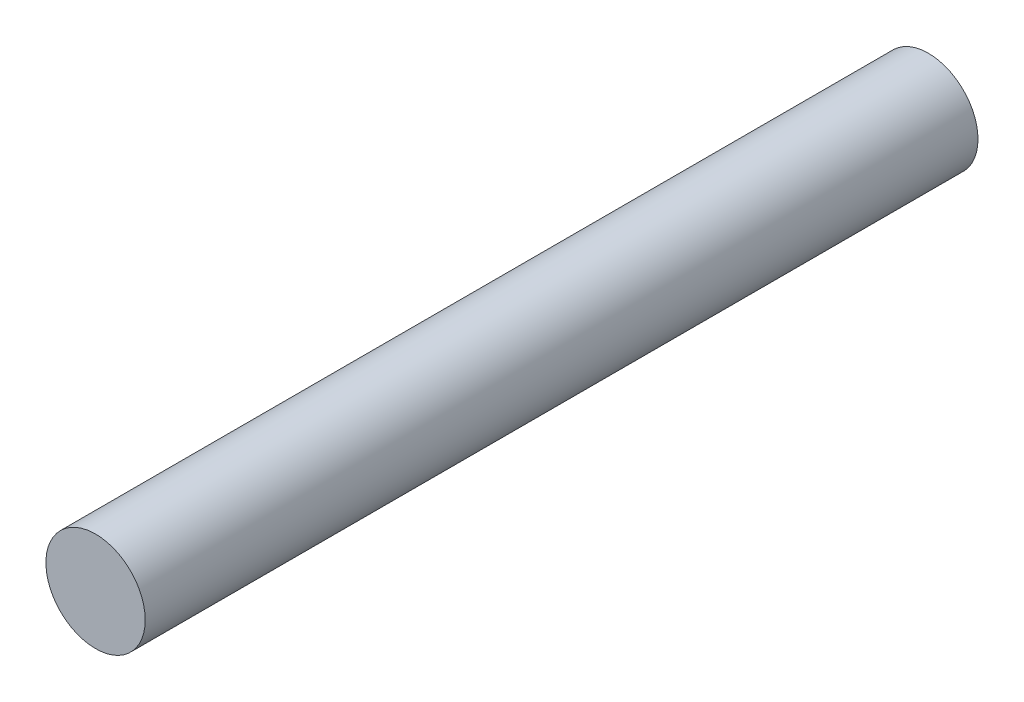
from build123d import *

# Parameters (mm, degrees)
SKETCH1_R           = 1.58
BOSS_EXTRUDE1_DEPTH = 26.5


with BuildPart() as part:
    # Sketch1 → Boss-Extrude1 (new body)
    with BuildSketch(Plane.XY):
        Circle(SKETCH1_R)
    extrude(amount=BOSS_EXTRUDE1_DEPTH)


solid = part.part
